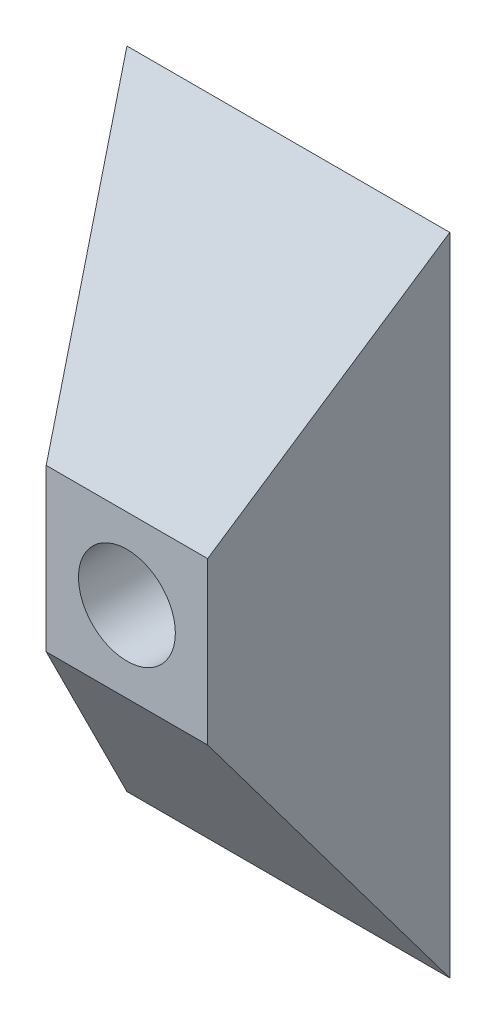
from build123d import *

# Parameters (mm, degrees)
CROQUIS10_R           = 1.5
CORTAR_EXTRUIR1_DEPTH = 5
CROQUIS11_R           = 2.5
CORTAR_EXTRUIR2_DEPTH = 2


with BuildPart() as part:
    # Croquis1 → Recubrir1 section 0
    with BuildSketch(Plane.XY):
        with BuildLine():
            Line((-5, -10), (5, -10))
            Line((5, -10), (5, 10))
            Line((5, 10), (-5, 10))
            Line((-5, 10), (-5, -10))
        make_face()
    # Croquis9 → Recubrir1 section 1
    with BuildSketch(Plane.XY.offset(5)):
        with BuildLine():
            Line((-2.5, 2.5), (2.5, 2.5))
            Line((2.5, 2.5), (2.5, -2.5))
            Line((2.5, -2.5), (-2.5, -2.5))
            Line((-2.5, -2.5), (-2.5, 2.5))
        make_face()
    loft()

    # Croquis10 → Cortar-Extruir1 (cut)
    with BuildSketch(Plane.XY.offset(5)):
        Circle(CROQUIS10_R)
    extrude(amount=-CORTAR_EXTRUIR1_DEPTH, mode=Mode.SUBTRACT)

    # Croquis11 → Cortar-Extruir2 (cut)
    with BuildSketch(Plane(origin=(0, 0, 0), x_dir=(-1, 0, 0), z_dir=(0, 0, -1))):
        Circle(CROQUIS11_R)
    extrude(amount=-CORTAR_EXTRUIR2_DEPTH, mode=Mode.SUBTRACT)


solid = part.part
